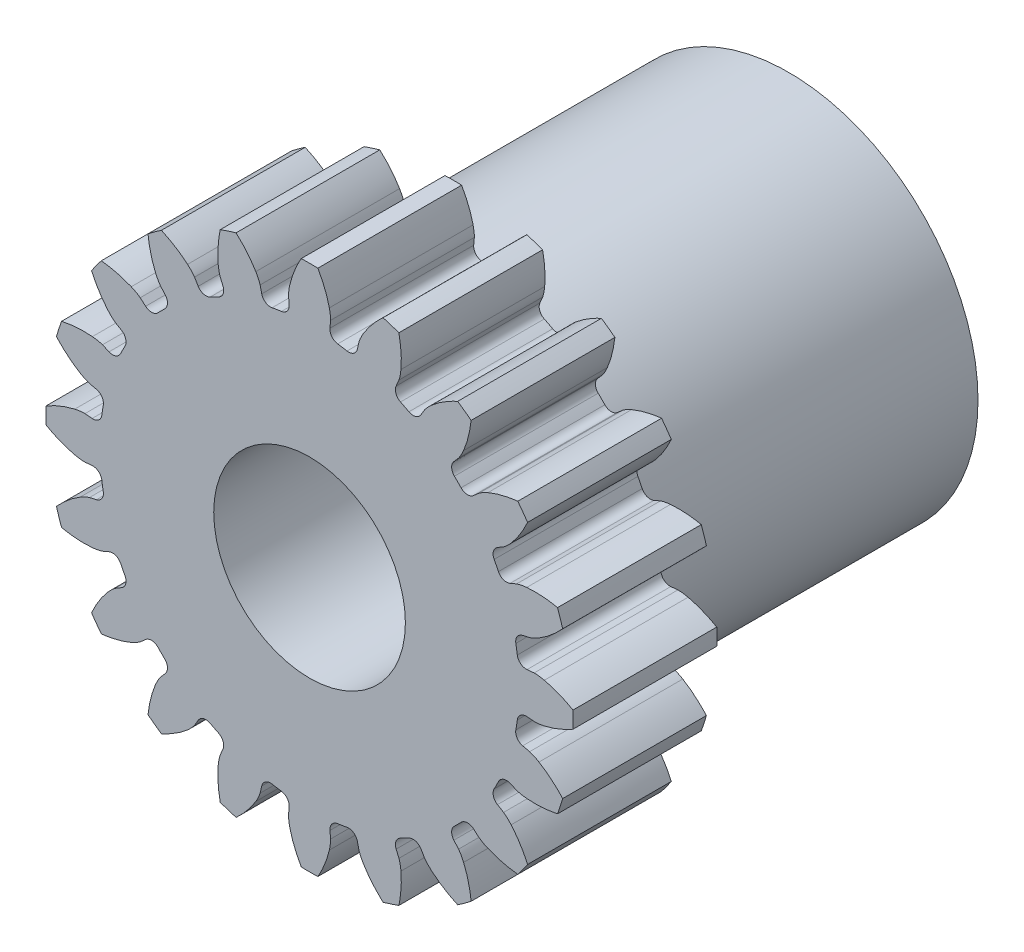
from build123d import *

# Parameters (mm, degrees)
GEAR_DEPTH          = 3
SKETCH2_R           = 2
CUT_EXTRUDE1_DEPTH  = 9.33738853
BOSS_EXTRUDE2_START = 7
SKETCH3_R           = 3.95
SKETCH3_R_2         = 2
BOSS_EXTRUDE2_DEPTH = 7


with BuildPart() as part:
    # Sketch1 → Gear (new body)
    with BuildSketch(Plane(origin=(0, 0, 0), x_dir=(-1, 0, 0), z_dir=(0, 0, -1))):
        with BuildLine():
            Line((-4.447597009, -0.997907739), (-4.593150548, -1.030951362))
            add(Edge.make_bspline(
                [(-4.593150548, -1.030951362), (-4.607739563, -1.035181454), (-4.622055526, -1.040358785), (-4.636198283, -1.045900937), (-4.662441481, -1.056184915), (-4.688118407, -1.067952908), (-4.713324038, -1.08056805), (-4.738693189, -1.093265033), (-4.763614791, -1.106879219), (-4.788129339, -1.12115662)],
                knots=[0, 0, 0, 0, 4.557e-05, 4.557e-05, 4.557e-05, 0.000130165, 0.000130165, 0.000130165, 0.000215282, 0.000215282, 0.000215282, 0.000215282], degree=3))
            add(Edge.make_bspline(
                [(-4.788129339, -1.12115662), (-4.850531317, -1.157765967), (-4.910385417, -1.198902982), (-4.967788285, -1.242938898), (-5.024279533, -1.286275476), (-5.07855745, -1.332599816), (-5.130709538, -1.381071248), (-5.183277961, -1.429929632), (-5.233785889, -1.4810728), (-5.282338139, -1.533924098)],
                knots=[0, 0, 0, 0, 0.000217044, 0.000217044, 0.000217044, 0.000430529, 0.000430529, 0.000430529, 0.000645672, 0.000645672, 0.000645672, 0.000645672], degree=3))
            ThreePointArc((-5.282338139, -1.533924098), (-5.231331504, -1.699762643), (-5.175119287, -1.863909792))
            add(Edge.make_bspline(
                [(-5.175119287, -1.863909792), (-5.104303029, -1.878224391), (-5.032900278, -1.889973759), (-4.961170796, -1.898618501), (-4.89053115, -1.907131897), (-4.819435398, -1.912658885), (-4.748307578, -1.914467437), (-4.676414999, -1.916295434), (-4.604249783, -1.914376237), (-4.532677333, -1.907357053)],
                knots=[0, 0, 0, 0, 0.000216746, 0.000216746, 0.000216746, 0.000430242, 0.000430242, 0.000430242, 0.000646143, 0.000646143, 0.000646143, 0.000646143], degree=3))
            add(Edge.make_bspline(
                [(-4.532677333, -1.907357053), (-4.502477049, -1.904298338), (-4.47234349, -1.900353611), (-4.442423468, -1.895234504), (-4.422083324, -1.891754447), (-4.40182201, -1.887732217), (-4.381743733, -1.882968286), (-4.361550012, -1.878176964), (-4.341438488, -1.872769647), (-4.321914858, -1.865728981)],
                knots=[0, 0, 0, 0, 9.1064e-05, 9.1064e-05, 9.1064e-05, 0.000152959, 0.000152959, 0.000152959, 0.000215246, 0.000215246, 0.000215246, 0.000215246], degree=3))
            Line((-4.321914858, -1.865728981), (-4.184737016, -1.806907611))
            ThreePointArc((-4.184737016, -1.806907611), (-4.045056402, -1.803653853), (-3.941905868, -1.897894413))
            ThreePointArc((-3.941905868, -1.897894413), (-3.898153551, -1.98620844), (-3.852422969, -2.073514491))
            ThreePointArc((-3.852422969, -2.073514491), (-3.836810612, -2.212358376), (-3.921545667, -2.323449717))
            Line((-3.921545667, -2.323449717), (-4.049764268, -2.399854588))
            add(Edge.make_bspline(
                [(-4.049764268, -2.399854588), (-4.062332075, -2.408385898), (-4.074347482, -2.417733708), (-4.086085424, -2.42737496), (-4.107866264, -2.445265199), (-4.128649963, -2.464391831), (-4.148723649, -2.484178513), (-4.168927562, -2.504093561), (-4.188422399, -2.524742619), (-4.20732516, -2.545896646)],
                knots=[0, 0, 0, 0, 4.557e-05, 4.557e-05, 4.557e-05, 0.000130165, 0.000130165, 0.000130165, 0.000215282, 0.000215282, 0.000215282, 0.000215282], degree=3))
            add(Edge.make_bspline(
                [(-4.20732516, -2.545896646), (-4.255360057, -2.599997476), (-4.299572652, -2.657617037), (-4.340558177, -2.717236143), (-4.380892808, -2.775908434), (-4.418199167, -2.836738297), (-4.452820254, -2.898953251), (-4.487717723, -2.961664871), (-4.519949509, -3.025912722), (-4.549793494, -3.091180764)],
                knots=[0, 0, 0, 0, 0.000217044, 0.000217044, 0.000217044, 0.000430529, 0.000430529, 0.000430529, 0.000645672, 0.000645672, 0.000645672, 0.000645672], degree=3))
            ThreePointArc((-4.549793494, -3.091180764), (-4.450036373, -3.233140676), (-4.345851119, -3.371883362))
            add(Edge.make_bspline(
                [(-4.345851119, -3.371883362), (-4.274077401, -3.363613927), (-4.202538595, -3.352723576), (-4.131648432, -3.338779585), (-4.061835351, -3.325047455), (-3.99251134, -3.308334137), (-3.92430589, -3.288074467), (-3.855367103, -3.267596967), (-3.787326968, -3.243471424), (-3.72142657, -3.21467868)],
                knots=[0, 0, 0, 0, 0.000216746, 0.000216746, 0.000216746, 0.000430242, 0.000430242, 0.000430242, 0.000646143, 0.000646143, 0.000646143, 0.000646143], degree=3))
            add(Edge.make_bspline(
                [(-3.72142657, -3.21467868), (-3.693649588, -3.202437268), (-3.666209858, -3.189373828), (-3.639336118, -3.175259473), (-3.621066887, -3.165664292), (-3.60304017, -3.155577834), (-3.585416729, -3.144842537), (-3.56769196, -3.134045516), (-3.550235716, -3.122688049), (-3.533843326, -3.109958845)],
                knots=[0, 0, 0, 0, 9.1064e-05, 9.1064e-05, 9.1064e-05, 0.000152959, 0.000152959, 0.000152959, 0.000215246, 0.000215246, 0.000215246, 0.000215246], degree=3))
            Line((-3.533843326, -3.109958845), (-3.421556249, -3.011626113))
            ThreePointArc((-3.421556249, -3.011626113), (-3.289717557, -2.965367922), (-3.162493635, -3.023120752))
            ThreePointArc((-3.162493635, -3.023120752), (-3.093592174, -3.093592174), (-3.023120752, -3.162493635))
            ThreePointArc((-3.023120752, -3.162493635), (-2.965367398, -3.289717534), (-3.011626113, -3.421556249))
            Line((-3.011626113, -3.421556249), (-3.109958845, -3.533843326))
            add(Edge.make_bspline(
                [(-3.109958845, -3.533843326), (-3.11927522, -3.54584075), (-3.127813919, -3.558444011), (-3.135998054, -3.57124061), (-3.151184477, -3.594985888), (-3.165040494, -3.619598912), (-3.178017283, -3.644620275), (-3.191078258, -3.669803963), (-3.20323804, -3.695466621), (-3.21467868, -3.72142657)],
                knots=[0, 0, 0, 0, 4.557e-05, 4.557e-05, 4.557e-05, 0.000130165, 0.000130165, 0.000130165, 0.000215282, 0.000215282, 0.000215282, 0.000215282], degree=3))
            add(Edge.make_bspline(
                [(-3.21467868, -3.72142657), (-3.243644506, -3.787723117), (-3.267887759, -3.856185019), (-3.288443993, -3.925551382), (-3.308673772, -3.993816133), (-3.325356765, -4.06319707), (-3.339057898, -4.133065511), (-3.352868407, -4.203491717), (-3.363668979, -4.274555224), (-3.371883362, -4.345851119)],
                knots=[0, 0, 0, 0, 0.000217044, 0.000217044, 0.000217044, 0.000430529, 0.000430529, 0.000430529, 0.000645672, 0.000645672, 0.000645672, 0.000645672], degree=3))
            ThreePointArc((-3.371883362, -4.345851119), (-3.233140676, -4.450036373), (-3.091180764, -4.549793494))
            add(Edge.make_bspline(
                [(-3.091180764, -4.549793494), (-3.025475297, -4.519749495), (-2.960803153, -4.48728545), (-2.897691532, -4.452117661), (-2.835538809, -4.417484201), (-2.774772455, -4.380166594), (-2.7161658, -4.339821859), (-2.656929012, -4.299043342), (-2.599674201, -4.255073029), (-2.545896646, -4.20732516)],
                knots=[0, 0, 0, 0, 0.000216746, 0.000216746, 0.000216746, 0.000430242, 0.000430242, 0.000430242, 0.000646143, 0.000646143, 0.000646143, 0.000646143], degree=3))
            add(Edge.make_bspline(
                [(-2.545896646, -4.20732516), (-2.52326197, -4.187099325), (-2.501202061, -4.166195913), (-2.480005191, -4.144467921), (-2.465595194, -4.129696859), (-2.451567655, -4.114533505), (-2.438124156, -4.098877689), (-2.424603361, -4.083131857), (-2.411511137, -4.066935988), (-2.399854588, -4.049764268)],
                knots=[0, 0, 0, 0, 9.1064e-05, 9.1064e-05, 9.1064e-05, 0.000152959, 0.000152959, 0.000152959, 0.000215246, 0.000215246, 0.000215246, 0.000215246], degree=3))
            Line((-2.399854588, -4.049764268), (-2.323449717, -3.921545667))
            ThreePointArc((-2.323449717, -3.921545667), (-2.212358237, -3.836811117), (-2.073514491, -3.852422969))
            ThreePointArc((-2.073514491, -3.852422969), (-1.98620844, -3.898153551), (-1.897894413, -3.941905868))
            ThreePointArc((-1.897894413, -3.941905868), (-1.803653363, -4.045056218), (-1.806907611, -4.184737016))
            Line((-1.806907611, -4.184737016), (-1.865728981, -4.321914858))
            add(Edge.make_bspline(
                [(-1.865728981, -4.321914858), (-1.870881973, -4.336204004), (-1.875108136, -4.35082902), (-1.878937345, -4.365528346), (-1.886042797, -4.39280431), (-1.891614809, -4.420494432), (-1.896224443, -4.448301211), (-1.900863981, -4.476288385), (-1.904498424, -4.504452602), (-1.907357053, -4.532677333)],
                knots=[0, 0, 0, 0, 4.557e-05, 4.557e-05, 4.557e-05, 0.000130165, 0.000130165, 0.000130165, 0.000215282, 0.000215282, 0.000215282, 0.000215282], degree=3))
            add(Edge.make_bspline(
                [(-1.907357053, -4.532677333), (-1.914418431, -4.604680028), (-1.916319244, -4.677282743), (-1.914433999, -4.749606301), (-1.912578693, -4.820781282), (-1.907005274, -4.891921803), (-1.89844529, -4.962604522), (-1.889816971, -5.033851506), (-1.878129094, -5.104774478), (-1.863909792, -5.175119287)],
                knots=[0, 0, 0, 0, 0.000217044, 0.000217044, 0.000217044, 0.000430529, 0.000430529, 0.000430529, 0.000645672, 0.000645672, 0.000645672, 0.000645672], degree=3))
            ThreePointArc((-1.863909792, -5.175119287), (-1.699762643, -5.231331504), (-1.533924098, -5.282338139))
            add(Edge.make_bspline(
                [(-1.533924098, -5.282338139), (-1.480718592, -5.233460493), (-1.42924367, -5.182600559), (-1.380088395, -5.129651441), (-1.331679971, -5.077506815), (-1.285419509, -5.023237826), (-1.242148476, -4.966757251), (-1.198412198, -4.909669402), (-1.157547211, -4.85015844), (-1.12115662, -4.788129339)],
                knots=[0, 0, 0, 0, 0.000216746, 0.000216746, 0.000216746, 0.000430242, 0.000430242, 0.000430242, 0.000646143, 0.000646143, 0.000646143, 0.000646143], degree=3))
            add(Edge.make_bspline(
                [(-1.12115662, -4.788129339), (-1.105879891, -4.761898928), (-1.09135918, -4.735201714), (-1.077914077, -4.707986973), (-1.068773865, -4.689485925), (-1.060118616, -4.67072997), (-1.052171002, -4.651686134), (-1.044177692, -4.632532803), (-1.036731046, -4.613083896), (-1.030951362, -4.593150548)],
                knots=[0, 0, 0, 0, 9.1064e-05, 9.1064e-05, 9.1064e-05, 0.000152959, 0.000152959, 0.000152959, 0.000215246, 0.000215246, 0.000215246, 0.000215246], degree=3))
            Line((-1.030951362, -4.593150548), (-0.997907739, -4.447597009))
            ThreePointArc((-0.997907739, -4.447597009), (-0.918437878, -4.332680507), (-0.781565302, -4.304623184))
            ThreePointArc((-0.781565302, -4.304623184), (-0.684400786, -4.321136498), (-0.586888945, -4.335456889))
            ThreePointArc((-0.586888945, -4.335456889), (-0.465385169, -4.404436616), (-0.425316402, -4.538286567))
            Line((-0.425316402, -4.538286567), (-0.438868566, -4.68692725))
            add(Edge.make_bspline(
                [(-0.438868566, -4.68692725), (-0.439353763, -4.702109398), (-0.438853705, -4.717324571), (-0.437953157, -4.732487752), (-0.436282107, -4.76062444), (-0.433024688, -4.788681158), (-0.428815942, -4.816551431), (-0.424579893, -4.844602511), (-0.419333232, -4.872511378), (-0.413330028, -4.900238058)],
                knots=[0, 0, 0, 0, 4.557e-05, 4.557e-05, 4.557e-05, 0.000130165, 0.000130165, 0.000130165, 0.000215282, 0.000215282, 0.000215282, 0.000215282], degree=3))
            add(Edge.make_bspline(
                [(-0.413330028, -4.900238058), (-0.397795742, -4.970898776), (-0.377168049, -5.040535445), (-0.353025866, -5.108736663), (-0.329267087, -5.175854771), (-0.301982821, -5.241791146), (-0.27199963, -5.306369226), (-0.241777082, -5.371462837), (-0.208744847, -5.435302839), (-0.173483746, -5.497810722)],
                knots=[0, 0, 0, 0, 0.000217044, 0.000217044, 0.000217044, 0.000430529, 0.000430529, 0.000430529, 0.000645672, 0.000645672, 0.000645672, 0.000645672], degree=3))
            ThreePointArc((-0.173483746, -5.497810722), (0, -5.500547459), (0.173483746, -5.497810722))
            add(Edge.make_bspline(
                [(0.173483746, -5.497810722), (0.208981166, -5.434883913), (0.242220142, -5.370606616), (0.272607409, -5.305059197), (0.302532981, -5.240507685), (0.329759255, -5.17459954), (0.353458995, -5.107511837), (0.377413552, -5.039702813), (0.397888565, -4.970476549), (0.413330028, -4.900238058)],
                knots=[0, 0, 0, 0, 0.000216746, 0.000216746, 0.000216746, 0.000430242, 0.000430242, 0.000430242, 0.000646143, 0.000646143, 0.000646143, 0.000646143], degree=3))
            add(Edge.make_bspline(
                [(0.413330028, -4.900238058), (0.419753418, -4.870570685), (0.425313542, -4.84069298), (0.429690777, -4.810655458), (0.432666497, -4.790235434), (0.435102219, -4.769722842), (0.43677598, -4.74915513), (0.438459365, -4.728469161), (0.439531503, -4.707671011), (0.438868566, -4.68692725)],
                knots=[0, 0, 0, 0, 9.1064e-05, 9.1064e-05, 9.1064e-05, 0.000152959, 0.000152959, 0.000152959, 0.000215246, 0.000215246, 0.000215246, 0.000215246], degree=3))
            Line((0.438868566, -4.68692725), (0.425316402, -4.538286567))
            ThreePointArc((0.425316402, -4.538286567), (0.465385579, -4.404436942), (0.586888945, -4.335456889))
            ThreePointArc((0.586888945, -4.335456889), (0.684400786, -4.321136498), (0.781565302, -4.304623184))
            ThreePointArc((0.781565302, -4.304623184), (0.918438167, -4.33268007), (0.997907739, -4.447597009))
            Line((0.997907739, -4.447597009), (1.030951362, -4.593150548))
            add(Edge.make_bspline(
                [(1.030951362, -4.593150548), (1.035181454, -4.607739563), (1.040358785, -4.622055526), (1.045900937, -4.636198283), (1.056184915, -4.662441481), (1.067952908, -4.688118407), (1.08056805, -4.713324038), (1.093265033, -4.738693189), (1.106879219, -4.763614791), (1.12115662, -4.788129339)],
                knots=[0, 0, 0, 0, 4.557e-05, 4.557e-05, 4.557e-05, 0.000130165, 0.000130165, 0.000130165, 0.000215282, 0.000215282, 0.000215282, 0.000215282], degree=3))
            add(Edge.make_bspline(
                [(1.12115662, -4.788129339), (1.157765967, -4.850531317), (1.198902982, -4.910385417), (1.242938898, -4.967788285), (1.286275476, -5.024279533), (1.332599816, -5.07855745), (1.381071248, -5.130709538), (1.429929632, -5.183277961), (1.4810728, -5.233785889), (1.533924098, -5.282338139)],
                knots=[0, 0, 0, 0, 0.000217044, 0.000217044, 0.000217044, 0.000430529, 0.000430529, 0.000430529, 0.000645672, 0.000645672, 0.000645672, 0.000645672], degree=3))
            ThreePointArc((1.533924098, -5.282338139), (1.699762643, -5.231331504), (1.863909792, -5.175119287))
            add(Edge.make_bspline(
                [(1.863909792, -5.175119287), (1.878224391, -5.104303029), (1.889973759, -5.032900278), (1.898618501, -4.961170796), (1.907131897, -4.89053115), (1.912658885, -4.819435398), (1.914467437, -4.748307578), (1.916295434, -4.676414999), (1.914376237, -4.604249783), (1.907357053, -4.532677333)],
                knots=[0, 0, 0, 0, 0.000216746, 0.000216746, 0.000216746, 0.000430242, 0.000430242, 0.000430242, 0.000646143, 0.000646143, 0.000646143, 0.000646143], degree=3))
            add(Edge.make_bspline(
                [(1.907357053, -4.532677333), (1.904298338, -4.502477049), (1.900353611, -4.472343489), (1.895234504, -4.442423468), (1.891754447, -4.422083324), (1.887732217, -4.40182201), (1.882968286, -4.381743733), (1.878176964, -4.361550012), (1.872769647, -4.341438488), (1.865728981, -4.321914858)],
                knots=[0, 0, 0, 0, 9.1064e-05, 9.1064e-05, 9.1064e-05, 0.000152959, 0.000152959, 0.000152959, 0.000215246, 0.000215246, 0.000215246, 0.000215246], degree=3))
            Line((1.865728981, -4.321914858), (1.806907611, -4.184737016))
            ThreePointArc((1.806907611, -4.184737016), (1.803653853, -4.045056402), (1.897894413, -3.941905868))
            ThreePointArc((1.897894413, -3.941905868), (1.98620844, -3.898153551), (2.073514491, -3.852422969))
            ThreePointArc((2.073514491, -3.852422969), (2.212358376, -3.836810612), (2.323449717, -3.921545667))
            Line((2.323449717, -3.921545667), (2.399854588, -4.049764268))
            add(Edge.make_bspline(
                [(2.399854588, -4.049764268), (2.408385898, -4.062332075), (2.417733708, -4.074347482), (2.42737496, -4.086085424), (2.445265199, -4.107866264), (2.464391831, -4.128649963), (2.484178513, -4.148723649), (2.504093561, -4.168927562), (2.524742619, -4.188422399), (2.545896646, -4.20732516)],
                knots=[0, 0, 0, 0, 4.557e-05, 4.557e-05, 4.557e-05, 0.000130165, 0.000130165, 0.000130165, 0.000215282, 0.000215282, 0.000215282, 0.000215282], degree=3))
            add(Edge.make_bspline(
                [(2.545896646, -4.20732516), (2.599997476, -4.255360057), (2.657617037, -4.299572652), (2.717236143, -4.340558177), (2.775908434, -4.380892808), (2.836738297, -4.418199167), (2.898953251, -4.452820254), (2.961664871, -4.487717723), (3.025912722, -4.519949509), (3.091180764, -4.549793494)],
                knots=[0, 0, 0, 0, 0.000217044, 0.000217044, 0.000217044, 0.000430529, 0.000430529, 0.000430529, 0.000645672, 0.000645672, 0.000645672, 0.000645672], degree=3))
            ThreePointArc((3.091180764, -4.549793494), (3.233140676, -4.450036373), (3.371883362, -4.345851119))
            add(Edge.make_bspline(
                [(3.371883362, -4.345851119), (3.363613927, -4.274077401), (3.352723576, -4.202538595), (3.338779585, -4.131648432), (3.325047455, -4.061835351), (3.308334137, -3.99251134), (3.288074467, -3.92430589), (3.267596967, -3.855367103), (3.243471424, -3.787326968), (3.21467868, -3.72142657)],
                knots=[0, 0, 0, 0, 0.000216746, 0.000216746, 0.000216746, 0.000430242, 0.000430242, 0.000430242, 0.000646143, 0.000646143, 0.000646143, 0.000646143], degree=3))
            add(Edge.make_bspline(
                [(3.21467868, -3.72142657), (3.202437268, -3.693649588), (3.189373828, -3.666209858), (3.175259473, -3.639336118), (3.165664292, -3.621066887), (3.155577834, -3.60304017), (3.144842537, -3.585416729), (3.134045516, -3.56769196), (3.122688049, -3.550235716), (3.109958845, -3.533843326)],
                knots=[0, 0, 0, 0, 9.1064e-05, 9.1064e-05, 9.1064e-05, 0.000152959, 0.000152959, 0.000152959, 0.000215246, 0.000215246, 0.000215246, 0.000215246], degree=3))
            Line((3.109958845, -3.533843326), (3.011626113, -3.421556249))
            ThreePointArc((3.011626113, -3.421556249), (2.965367922, -3.289717557), (3.023120752, -3.162493635))
            ThreePointArc((3.023120752, -3.162493635), (3.093592174, -3.093592174), (3.162493635, -3.023120752))
            ThreePointArc((3.162493635, -3.023120752), (3.289717534, -2.965367398), (3.421556249, -3.011626113))
            Line((3.421556249, -3.011626113), (3.533843326, -3.109958845))
            add(Edge.make_bspline(
                [(3.533843326, -3.109958845), (3.54584075, -3.11927522), (3.558444011, -3.127813919), (3.57124061, -3.135998054), (3.594985888, -3.151184477), (3.619598912, -3.165040494), (3.644620275, -3.178017283), (3.669803963, -3.191078258), (3.695466621, -3.20323804), (3.72142657, -3.21467868)],
                knots=[0, 0, 0, 0, 4.557e-05, 4.557e-05, 4.557e-05, 0.000130165, 0.000130165, 0.000130165, 0.000215282, 0.000215282, 0.000215282, 0.000215282], degree=3))
            add(Edge.make_bspline(
                [(3.72142657, -3.21467868), (3.787723117, -3.243644506), (3.856185019, -3.267887759), (3.925551382, -3.288443993), (3.993816133, -3.308673772), (4.06319707, -3.325356765), (4.133065511, -3.339057898), (4.203491717, -3.352868407), (4.274555224, -3.363668979), (4.345851119, -3.371883362)],
                knots=[0, 0, 0, 0, 0.000217044, 0.000217044, 0.000217044, 0.000430529, 0.000430529, 0.000430529, 0.000645672, 0.000645672, 0.000645672, 0.000645672], degree=3))
            ThreePointArc((4.345851119, -3.371883362), (4.450036373, -3.233140676), (4.549793494, -3.091180764))
            add(Edge.make_bspline(
                [(4.549793494, -3.091180764), (4.519749495, -3.025475297), (4.48728545, -2.960803153), (4.452117661, -2.897691532), (4.417484201, -2.835538809), (4.380166594, -2.774772455), (4.339821859, -2.7161658), (4.299043342, -2.656929012), (4.255073029, -2.599674201), (4.20732516, -2.545896646)],
                knots=[0, 0, 0, 0, 0.000216746, 0.000216746, 0.000216746, 0.000430242, 0.000430242, 0.000430242, 0.000646143, 0.000646143, 0.000646143, 0.000646143], degree=3))
            add(Edge.make_bspline(
                [(4.20732516, -2.545896646), (4.187099325, -2.52326197), (4.166195913, -2.501202061), (4.144467921, -2.480005191), (4.129696859, -2.465595194), (4.114533505, -2.451567655), (4.098877689, -2.438124155), (4.083131857, -2.424603361), (4.066935988, -2.411511137), (4.049764268, -2.399854588)],
                knots=[0, 0, 0, 0, 9.1064e-05, 9.1064e-05, 9.1064e-05, 0.000152959, 0.000152959, 0.000152959, 0.000215246, 0.000215246, 0.000215246, 0.000215246], degree=3))
            Line((4.049764268, -2.399854588), (3.921545667, -2.323449717))
            ThreePointArc((3.921545667, -2.323449717), (3.836811117, -2.212358237), (3.852422969, -2.073514491))
            ThreePointArc((3.852422969, -2.073514491), (3.898153551, -1.98620844), (3.941905868, -1.897894413))
            ThreePointArc((3.941905868, -1.897894413), (4.045056218, -1.803653363), (4.184737016, -1.806907611))
            Line((4.184737016, -1.806907611), (4.321914858, -1.865728981))
            add(Edge.make_bspline(
                [(4.321914858, -1.865728981), (4.336204004, -1.870881973), (4.35082902, -1.875108136), (4.365528346, -1.878937345), (4.39280431, -1.886042797), (4.420494432, -1.891614809), (4.448301211, -1.896224443), (4.476288385, -1.900863981), (4.504452602, -1.904498424), (4.532677333, -1.907357053)],
                knots=[0, 0, 0, 0, 4.557e-05, 4.557e-05, 4.557e-05, 0.000130165, 0.000130165, 0.000130165, 0.000215282, 0.000215282, 0.000215282, 0.000215282], degree=3))
            add(Edge.make_bspline(
                [(4.532677333, -1.907357053), (4.604680028, -1.914418431), (4.677282743, -1.916319244), (4.749606301, -1.914433999), (4.820781282, -1.912578693), (4.891921803, -1.907005274), (4.962604522, -1.89844529), (5.033851506, -1.889816971), (5.104774478, -1.878129094), (5.175119287, -1.863909792)],
                knots=[0, 0, 0, 0, 0.000217044, 0.000217044, 0.000217044, 0.000430529, 0.000430529, 0.000430529, 0.000645672, 0.000645672, 0.000645672, 0.000645672], degree=3))
            ThreePointArc((5.175119287, -1.863909792), (5.231331504, -1.699762643), (5.282338139, -1.533924098))
            add(Edge.make_bspline(
                [(5.282338139, -1.533924098), (5.233460493, -1.480718592), (5.182600559, -1.42924367), (5.129651441, -1.380088395), (5.077506815, -1.331679971), (5.023237826, -1.285419509), (4.966757251, -1.242148476), (4.909669402, -1.198412198), (4.85015844, -1.157547211), (4.788129339, -1.12115662)],
                knots=[0, 0, 0, 0, 0.000216746, 0.000216746, 0.000216746, 0.000430242, 0.000430242, 0.000430242, 0.000646143, 0.000646143, 0.000646143, 0.000646143], degree=3))
            add(Edge.make_bspline(
                [(4.788129339, -1.12115662), (4.761898928, -1.105879891), (4.735201714, -1.09135918), (4.707986973, -1.077914077), (4.689485925, -1.068773865), (4.67072997, -1.060118616), (4.651686134, -1.052171002), (4.632532803, -1.044177692), (4.613083896, -1.036731046), (4.593150548, -1.030951362)],
                knots=[0, 0, 0, 0, 9.1064e-05, 9.1064e-05, 9.1064e-05, 0.000152959, 0.000152959, 0.000152959, 0.000215246, 0.000215246, 0.000215246, 0.000215246], degree=3))
            Line((4.593150548, -1.030951362), (4.447597009, -0.997907739))
            ThreePointArc((4.447597009, -0.997907739), (4.332680507, -0.918437878), (4.304623184, -0.781565302))
            ThreePointArc((4.304623184, -0.781565302), (4.321136498, -0.684400786), (4.335456889, -0.586888945))
            ThreePointArc((4.335456889, -0.586888945), (4.404436616, -0.465385169), (4.538286567, -0.425316402))
            Line((4.538286567, -0.425316402), (4.68692725, -0.438868566))
            add(Edge.make_bspline(
                [(4.68692725, -0.438868566), (4.702109398, -0.439353763), (4.717324571, -0.438853705), (4.732487752, -0.437953157), (4.76062444, -0.436282107), (4.788681158, -0.433024688), (4.816551431, -0.428815942), (4.844602511, -0.424579893), (4.872511378, -0.419333232), (4.900238058, -0.413330028)],
                knots=[0, 0, 0, 0, 4.557e-05, 4.557e-05, 4.557e-05, 0.000130165, 0.000130165, 0.000130165, 0.000215282, 0.000215282, 0.000215282, 0.000215282], degree=3))
            add(Edge.make_bspline(
                [(4.900238058, -0.413330028), (4.970898776, -0.397795742), (5.040535445, -0.377168049), (5.108736663, -0.353025866), (5.175854771, -0.329267087), (5.241791146, -0.301982821), (5.306369226, -0.27199963), (5.371462837, -0.241777082), (5.435302839, -0.208744847), (5.497810722, -0.173483746)],
                knots=[0, 0, 0, 0, 0.000217044, 0.000217044, 0.000217044, 0.000430529, 0.000430529, 0.000430529, 0.000645672, 0.000645672, 0.000645672, 0.000645672], degree=3))
            ThreePointArc((5.497810722, -0.173483746), (5.500547459, 0), (5.497810722, 0.173483746))
            add(Edge.make_bspline(
                [(5.497810722, 0.173483746), (5.434883913, 0.208981166), (5.370606616, 0.242220142), (5.305059197, 0.272607409), (5.240507685, 0.302532981), (5.17459954, 0.329759255), (5.107511837, 0.353458995), (5.039702813, 0.377413552), (4.970476549, 0.397888565), (4.900238058, 0.413330028)],
                knots=[0, 0, 0, 0, 0.000216746, 0.000216746, 0.000216746, 0.000430242, 0.000430242, 0.000430242, 0.000646143, 0.000646143, 0.000646143, 0.000646143], degree=3))
            add(Edge.make_bspline(
                [(4.900238058, 0.413330028), (4.870570685, 0.419753418), (4.84069298, 0.425313542), (4.810655458, 0.429690777), (4.790235434, 0.432666497), (4.769722842, 0.435102219), (4.74915513, 0.43677598), (4.728469161, 0.438459365), (4.707671011, 0.439531503), (4.68692725, 0.438868566)],
                knots=[0, 0, 0, 0, 9.1064e-05, 9.1064e-05, 9.1064e-05, 0.000152959, 0.000152959, 0.000152959, 0.000215246, 0.000215246, 0.000215246, 0.000215246], degree=3))
            Line((4.68692725, 0.438868566), (4.538286567, 0.425316402))
            ThreePointArc((4.538286567, 0.425316402), (4.404436942, 0.465385579), (4.335456889, 0.586888945))
            ThreePointArc((4.335456889, 0.586888945), (4.321136498, 0.684400786), (4.304623184, 0.781565302))
            ThreePointArc((4.304623184, 0.781565302), (4.33268007, 0.918438167), (4.447597009, 0.997907739))
            Line((4.447597009, 0.997907739), (4.593150548, 1.030951362))
            add(Edge.make_bspline(
                [(4.593150548, 1.030951362), (4.607739563, 1.035181454), (4.622055526, 1.040358785), (4.636198283, 1.045900937), (4.662441481, 1.056184915), (4.688118407, 1.067952908), (4.713324038, 1.08056805), (4.738693189, 1.093265033), (4.763614791, 1.106879219), (4.788129339, 1.12115662)],
                knots=[0, 0, 0, 0, 4.557e-05, 4.557e-05, 4.557e-05, 0.000130165, 0.000130165, 0.000130165, 0.000215282, 0.000215282, 0.000215282, 0.000215282], degree=3))
            add(Edge.make_bspline(
                [(4.788129339, 1.12115662), (4.850531317, 1.157765967), (4.910385417, 1.198902982), (4.967788285, 1.242938898), (5.024279533, 1.286275476), (5.07855745, 1.332599816), (5.130709538, 1.381071248), (5.183277961, 1.429929632), (5.233785889, 1.4810728), (5.282338139, 1.533924098)],
                knots=[0, 0, 0, 0, 0.000217044, 0.000217044, 0.000217044, 0.000430529, 0.000430529, 0.000430529, 0.000645672, 0.000645672, 0.000645672, 0.000645672], degree=3))
            ThreePointArc((5.282338139, 1.533924098), (5.231331504, 1.699762643), (5.175119287, 1.863909792))
            add(Edge.make_bspline(
                [(5.175119287, 1.863909792), (5.104303029, 1.878224391), (5.032900278, 1.889973759), (4.961170796, 1.898618501), (4.89053115, 1.907131897), (4.819435398, 1.912658885), (4.748307578, 1.914467437), (4.676414999, 1.916295434), (4.604249783, 1.914376237), (4.532677333, 1.907357053)],
                knots=[0, 0, 0, 0, 0.000216746, 0.000216746, 0.000216746, 0.000430242, 0.000430242, 0.000430242, 0.000646143, 0.000646143, 0.000646143, 0.000646143], degree=3))
            add(Edge.make_bspline(
                [(4.532677333, 1.907357053), (4.502477049, 1.904298338), (4.472343489, 1.900353611), (4.442423468, 1.895234504), (4.422083324, 1.891754447), (4.40182201, 1.887732217), (4.381743733, 1.882968286), (4.361550012, 1.878176964), (4.341438488, 1.872769647), (4.321914858, 1.865728981)],
                knots=[0, 0, 0, 0, 9.1064e-05, 9.1064e-05, 9.1064e-05, 0.000152959, 0.000152959, 0.000152959, 0.000215246, 0.000215246, 0.000215246, 0.000215246], degree=3))
            Line((4.321914858, 1.865728981), (4.184737016, 1.806907611))
            ThreePointArc((4.184737016, 1.806907611), (4.045056402, 1.803653853), (3.941905868, 1.897894413))
            ThreePointArc((3.941905868, 1.897894413), (3.898153551, 1.98620844), (3.852422969, 2.073514491))
            ThreePointArc((3.852422969, 2.073514491), (3.836810612, 2.212358376), (3.921545667, 2.323449717))
            Line((3.921545667, 2.323449717), (4.049764268, 2.399854588))
            add(Edge.make_bspline(
                [(4.049764268, 2.399854588), (4.062332075, 2.408385898), (4.074347482, 2.417733708), (4.086085424, 2.42737496), (4.107866264, 2.445265199), (4.128649963, 2.464391831), (4.148723649, 2.484178513), (4.168927562, 2.504093561), (4.188422399, 2.524742619), (4.20732516, 2.545896646)],
                knots=[0, 0, 0, 0, 4.557e-05, 4.557e-05, 4.557e-05, 0.000130165, 0.000130165, 0.000130165, 0.000215282, 0.000215282, 0.000215282, 0.000215282], degree=3))
            add(Edge.make_bspline(
                [(4.20732516, 2.545896646), (4.255360057, 2.599997476), (4.299572652, 2.657617037), (4.340558177, 2.717236143), (4.380892808, 2.775908434), (4.418199167, 2.836738297), (4.452820254, 2.898953251), (4.487717723, 2.961664871), (4.519949509, 3.025912722), (4.549793494, 3.091180764)],
                knots=[0, 0, 0, 0, 0.000217044, 0.000217044, 0.000217044, 0.000430529, 0.000430529, 0.000430529, 0.000645672, 0.000645672, 0.000645672, 0.000645672], degree=3))
            ThreePointArc((4.549793494, 3.091180764), (4.450036373, 3.233140676), (4.345851119, 3.371883362))
            add(Edge.make_bspline(
                [(4.345851119, 3.371883362), (4.274077401, 3.363613927), (4.202538595, 3.352723576), (4.131648432, 3.338779585), (4.061835351, 3.325047455), (3.99251134, 3.308334137), (3.92430589, 3.288074467), (3.855367103, 3.267596967), (3.787326968, 3.243471424), (3.72142657, 3.21467868)],
                knots=[0, 0, 0, 0, 0.000216746, 0.000216746, 0.000216746, 0.000430242, 0.000430242, 0.000430242, 0.000646143, 0.000646143, 0.000646143, 0.000646143], degree=3))
            add(Edge.make_bspline(
                [(3.72142657, 3.21467868), (3.693649588, 3.202437268), (3.666209858, 3.189373828), (3.639336118, 3.175259473), (3.621066887, 3.165664292), (3.60304017, 3.155577834), (3.585416729, 3.144842537), (3.56769196, 3.134045516), (3.550235716, 3.122688049), (3.533843326, 3.109958845)],
                knots=[0, 0, 0, 0, 9.1064e-05, 9.1064e-05, 9.1064e-05, 0.000152959, 0.000152959, 0.000152959, 0.000215246, 0.000215246, 0.000215246, 0.000215246], degree=3))
            Line((3.533843326, 3.109958845), (3.421556249, 3.011626113))
            ThreePointArc((3.421556249, 3.011626113), (3.289717557, 2.965367922), (3.162493635, 3.023120752))
            ThreePointArc((3.162493635, 3.023120752), (3.093592174, 3.093592174), (3.023120752, 3.162493635))
            ThreePointArc((3.023120752, 3.162493635), (2.965367398, 3.289717534), (3.011626113, 3.421556249))
            Line((3.011626113, 3.421556249), (3.109958845, 3.533843326))
            add(Edge.make_bspline(
                [(3.109958845, 3.533843326), (3.11927522, 3.54584075), (3.127813919, 3.558444011), (3.135998054, 3.57124061), (3.151184477, 3.594985888), (3.165040494, 3.619598912), (3.178017283, 3.644620275), (3.191078258, 3.669803963), (3.20323804, 3.695466621), (3.21467868, 3.72142657)],
                knots=[0, 0, 0, 0, 4.557e-05, 4.557e-05, 4.557e-05, 0.000130165, 0.000130165, 0.000130165, 0.000215282, 0.000215282, 0.000215282, 0.000215282], degree=3))
            add(Edge.make_bspline(
                [(3.21467868, 3.72142657), (3.243644506, 3.787723117), (3.267887759, 3.856185019), (3.288443993, 3.925551382), (3.308673772, 3.993816133), (3.325356765, 4.06319707), (3.339057898, 4.133065511), (3.352868407, 4.203491717), (3.363668979, 4.274555224), (3.371883362, 4.345851119)],
                knots=[0, 0, 0, 0, 0.000217044, 0.000217044, 0.000217044, 0.000430529, 0.000430529, 0.000430529, 0.000645672, 0.000645672, 0.000645672, 0.000645672], degree=3))
            ThreePointArc((3.371883362, 4.345851119), (3.233140676, 4.450036373), (3.091180764, 4.549793494))
            add(Edge.make_bspline(
                [(3.091180764, 4.549793494), (3.025475297, 4.519749495), (2.960803153, 4.48728545), (2.897691532, 4.452117661), (2.835538809, 4.417484201), (2.774772455, 4.380166594), (2.7161658, 4.339821859), (2.656929012, 4.299043342), (2.599674201, 4.255073029), (2.545896646, 4.20732516)],
                knots=[0, 0, 0, 0, 0.000216746, 0.000216746, 0.000216746, 0.000430242, 0.000430242, 0.000430242, 0.000646143, 0.000646143, 0.000646143, 0.000646143], degree=3))
            add(Edge.make_bspline(
                [(2.545896646, 4.20732516), (2.52326197, 4.187099325), (2.501202061, 4.166195913), (2.480005191, 4.144467921), (2.465595194, 4.129696859), (2.451567655, 4.114533505), (2.438124156, 4.098877689), (2.424603361, 4.083131857), (2.411511137, 4.066935988), (2.399854588, 4.049764268)],
                knots=[0, 0, 0, 0, 9.1064e-05, 9.1064e-05, 9.1064e-05, 0.000152959, 0.000152959, 0.000152959, 0.000215246, 0.000215246, 0.000215246, 0.000215246], degree=3))
            Line((2.399854588, 4.049764268), (2.323449717, 3.921545667))
            ThreePointArc((2.323449717, 3.921545667), (2.212358237, 3.836811117), (2.073514491, 3.852422969))
            ThreePointArc((2.073514491, 3.852422969), (1.98620844, 3.898153551), (1.897894413, 3.941905868))
            ThreePointArc((1.897894413, 3.941905868), (1.803653363, 4.045056218), (1.806907611, 4.184737016))
            Line((1.806907611, 4.184737016), (1.865728981, 4.321914858))
            add(Edge.make_bspline(
                [(1.865728981, 4.321914858), (1.870881973, 4.336204004), (1.875108136, 4.35082902), (1.878937345, 4.365528346), (1.886042797, 4.39280431), (1.891614809, 4.420494432), (1.896224443, 4.448301211), (1.900863981, 4.476288385), (1.904498424, 4.504452602), (1.907357053, 4.532677333)],
                knots=[0, 0, 0, 0, 4.557e-05, 4.557e-05, 4.557e-05, 0.000130165, 0.000130165, 0.000130165, 0.000215282, 0.000215282, 0.000215282, 0.000215282], degree=3))
            add(Edge.make_bspline(
                [(1.907357053, 4.532677333), (1.914418431, 4.604680028), (1.916319244, 4.677282743), (1.914433999, 4.749606301), (1.912578693, 4.820781282), (1.907005274, 4.891921803), (1.89844529, 4.962604522), (1.889816971, 5.033851506), (1.878129094, 5.104774478), (1.863909792, 5.175119287)],
                knots=[0, 0, 0, 0, 0.000217044, 0.000217044, 0.000217044, 0.000430529, 0.000430529, 0.000430529, 0.000645672, 0.000645672, 0.000645672, 0.000645672], degree=3))
            ThreePointArc((1.863909792, 5.175119287), (1.699762643, 5.231331504), (1.533924098, 5.282338139))
            add(Edge.make_bspline(
                [(1.533924098, 5.282338139), (1.480718592, 5.233460493), (1.42924367, 5.182600559), (1.380088395, 5.129651441), (1.331679971, 5.077506815), (1.285419509, 5.023237826), (1.242148476, 4.966757251), (1.198412198, 4.909669402), (1.157547211, 4.85015844), (1.12115662, 4.788129339)],
                knots=[0, 0, 0, 0, 0.000216746, 0.000216746, 0.000216746, 0.000430242, 0.000430242, 0.000430242, 0.000646143, 0.000646143, 0.000646143, 0.000646143], degree=3))
            add(Edge.make_bspline(
                [(1.12115662, 4.788129339), (1.105879891, 4.761898928), (1.09135918, 4.735201714), (1.077914077, 4.707986973), (1.068773865, 4.689485925), (1.060118616, 4.67072997), (1.052171002, 4.651686134), (1.044177692, 4.632532803), (1.036731046, 4.613083896), (1.030951362, 4.593150548)],
                knots=[0, 0, 0, 0, 9.1064e-05, 9.1064e-05, 9.1064e-05, 0.000152959, 0.000152959, 0.000152959, 0.000215246, 0.000215246, 0.000215246, 0.000215246], degree=3))
            Line((1.030951362, 4.593150548), (0.997907739, 4.447597009))
            ThreePointArc((0.997907739, 4.447597009), (0.918437878, 4.332680507), (0.781565302, 4.304623184))
            ThreePointArc((0.781565302, 4.304623184), (0.684400786, 4.321136498), (0.586888945, 4.335456889))
            ThreePointArc((0.586888945, 4.335456889), (0.465385169, 4.404436616), (0.425316402, 4.538286567))
            Line((0.425316402, 4.538286567), (0.438868566, 4.68692725))
            add(Edge.make_bspline(
                [(0.438868566, 4.68692725), (0.439353763, 4.702109398), (0.438853705, 4.717324571), (0.437953157, 4.732487752), (0.436282107, 4.76062444), (0.433024688, 4.788681158), (0.428815942, 4.816551431), (0.424579893, 4.844602511), (0.419333232, 4.872511378), (0.413330028, 4.900238058)],
                knots=[0, 0, 0, 0, 4.557e-05, 4.557e-05, 4.557e-05, 0.000130165, 0.000130165, 0.000130165, 0.000215282, 0.000215282, 0.000215282, 0.000215282], degree=3))
            add(Edge.make_bspline(
                [(0.413330028, 4.900238058), (0.397795742, 4.970898776), (0.377168049, 5.040535445), (0.353025866, 5.108736663), (0.329267087, 5.175854771), (0.301982821, 5.241791146), (0.27199963, 5.306369226), (0.241777082, 5.371462837), (0.208744847, 5.435302839), (0.173483746, 5.497810722)],
                knots=[0, 0, 0, 0, 0.000217044, 0.000217044, 0.000217044, 0.000430529, 0.000430529, 0.000430529, 0.000645672, 0.000645672, 0.000645672, 0.000645672], degree=3))
            ThreePointArc((0.173483746, 5.497810722), (0, 5.500547459), (-0.173483746, 5.497810722))
            add(Edge.make_bspline(
                [(-0.173483746, 5.497810722), (-0.208981166, 5.434883913), (-0.242220142, 5.370606616), (-0.272607409, 5.305059197), (-0.302532981, 5.240507685), (-0.329759255, 5.17459954), (-0.353458995, 5.107511837), (-0.377413552, 5.039702813), (-0.397888565, 4.970476549), (-0.413330028, 4.900238058)],
                knots=[0, 0, 0, 0, 0.000216746, 0.000216746, 0.000216746, 0.000430242, 0.000430242, 0.000430242, 0.000646143, 0.000646143, 0.000646143, 0.000646143], degree=3))
            add(Edge.make_bspline(
                [(-0.413330028, 4.900238058), (-0.419753418, 4.870570685), (-0.425313542, 4.84069298), (-0.429690777, 4.810655458), (-0.432666497, 4.790235434), (-0.435102219, 4.769722842), (-0.43677598, 4.74915513), (-0.438459365, 4.728469161), (-0.439531503, 4.707671011), (-0.438868566, 4.68692725)],
                knots=[0, 0, 0, 0, 9.1064e-05, 9.1064e-05, 9.1064e-05, 0.000152959, 0.000152959, 0.000152959, 0.000215246, 0.000215246, 0.000215246, 0.000215246], degree=3))
            Line((-0.438868566, 4.68692725), (-0.425316402, 4.538286567))
            ThreePointArc((-0.425316402, 4.538286567), (-0.465385579, 4.404436942), (-0.586888945, 4.335456889))
            ThreePointArc((-0.586888945, 4.335456889), (-0.684400786, 4.321136498), (-0.781565302, 4.304623184))
            ThreePointArc((-0.781565302, 4.304623184), (-0.918438167, 4.33268007), (-0.997907739, 4.447597009))
            Line((-0.997907739, 4.447597009), (-1.030951362, 4.593150548))
            add(Edge.make_bspline(
                [(-1.030951362, 4.593150548), (-1.035181454, 4.607739563), (-1.040358785, 4.622055526), (-1.045900937, 4.636198283), (-1.056184915, 4.662441481), (-1.067952908, 4.688118407), (-1.08056805, 4.713324038), (-1.093265033, 4.738693189), (-1.106879219, 4.763614791), (-1.12115662, 4.788129339)],
                knots=[0, 0, 0, 0, 4.557e-05, 4.557e-05, 4.557e-05, 0.000130165, 0.000130165, 0.000130165, 0.000215282, 0.000215282, 0.000215282, 0.000215282], degree=3))
            add(Edge.make_bspline(
                [(-1.12115662, 4.788129339), (-1.157765967, 4.850531317), (-1.198902982, 4.910385417), (-1.242938898, 4.967788285), (-1.286275476, 5.024279533), (-1.332599816, 5.07855745), (-1.381071248, 5.130709538), (-1.429929632, 5.183277961), (-1.4810728, 5.233785889), (-1.533924098, 5.282338139)],
                knots=[0, 0, 0, 0, 0.000217044, 0.000217044, 0.000217044, 0.000430529, 0.000430529, 0.000430529, 0.000645672, 0.000645672, 0.000645672, 0.000645672], degree=3))
            ThreePointArc((-1.533924098, 5.282338139), (-1.699762643, 5.231331504), (-1.863909792, 5.175119287))
            add(Edge.make_bspline(
                [(-1.863909792, 5.175119287), (-1.878224391, 5.104303029), (-1.889973759, 5.032900278), (-1.898618501, 4.961170796), (-1.907131897, 4.89053115), (-1.912658885, 4.819435398), (-1.914467437, 4.748307578), (-1.916295434, 4.676414999), (-1.914376237, 4.604249783), (-1.907357053, 4.532677333)],
                knots=[0, 0, 0, 0, 0.000216746, 0.000216746, 0.000216746, 0.000430242, 0.000430242, 0.000430242, 0.000646143, 0.000646143, 0.000646143, 0.000646143], degree=3))
            add(Edge.make_bspline(
                [(-1.907357053, 4.532677333), (-1.904298338, 4.502477049), (-1.900353611, 4.47234349), (-1.895234504, 4.442423468), (-1.891754447, 4.422083324), (-1.887732217, 4.40182201), (-1.882968286, 4.381743733), (-1.878176964, 4.361550012), (-1.872769647, 4.341438488), (-1.865728981, 4.321914858)],
                knots=[0, 0, 0, 0, 9.1064e-05, 9.1064e-05, 9.1064e-05, 0.000152959, 0.000152959, 0.000152959, 0.000215246, 0.000215246, 0.000215246, 0.000215246], degree=3))
            Line((-1.865728981, 4.321914858), (-1.806907611, 4.184737016))
            ThreePointArc((-1.806907611, 4.184737016), (-1.803653853, 4.045056402), (-1.897894413, 3.941905868))
            ThreePointArc((-1.897894413, 3.941905868), (-1.98620844, 3.898153551), (-2.073514491, 3.852422969))
            ThreePointArc((-2.073514491, 3.852422969), (-2.212358376, 3.836810612), (-2.323449717, 3.921545667))
            Line((-2.323449717, 3.921545667), (-2.399854588, 4.049764268))
            add(Edge.make_bspline(
                [(-2.399854588, 4.049764268), (-2.408385898, 4.062332075), (-2.417733708, 4.074347482), (-2.42737496, 4.086085424), (-2.445265199, 4.107866264), (-2.464391831, 4.128649963), (-2.484178513, 4.148723649), (-2.504093561, 4.168927562), (-2.524742619, 4.188422399), (-2.545896646, 4.20732516)],
                knots=[0, 0, 0, 0, 4.557e-05, 4.557e-05, 4.557e-05, 0.000130165, 0.000130165, 0.000130165, 0.000215282, 0.000215282, 0.000215282, 0.000215282], degree=3))
            add(Edge.make_bspline(
                [(-2.545896646, 4.20732516), (-2.599997476, 4.255360057), (-2.657617037, 4.299572652), (-2.717236143, 4.340558177), (-2.775908434, 4.380892808), (-2.836738297, 4.418199167), (-2.898953251, 4.452820254), (-2.961664871, 4.487717723), (-3.025912722, 4.519949509), (-3.091180764, 4.549793494)],
                knots=[0, 0, 0, 0, 0.000217044, 0.000217044, 0.000217044, 0.000430529, 0.000430529, 0.000430529, 0.000645672, 0.000645672, 0.000645672, 0.000645672], degree=3))
            ThreePointArc((-3.091180764, 4.549793494), (-3.233140676, 4.450036373), (-3.371883362, 4.345851119))
            add(Edge.make_bspline(
                [(-3.371883362, 4.345851119), (-3.363613927, 4.274077401), (-3.352723576, 4.202538595), (-3.338779585, 4.131648432), (-3.325047455, 4.061835351), (-3.308334137, 3.99251134), (-3.288074467, 3.92430589), (-3.267596967, 3.855367103), (-3.243471424, 3.787326968), (-3.21467868, 3.72142657)],
                knots=[0, 0, 0, 0, 0.000216746, 0.000216746, 0.000216746, 0.000430242, 0.000430242, 0.000430242, 0.000646143, 0.000646143, 0.000646143, 0.000646143], degree=3))
            add(Edge.make_bspline(
                [(-3.21467868, 3.72142657), (-3.202437268, 3.693649588), (-3.189373828, 3.666209858), (-3.175259473, 3.639336118), (-3.165664292, 3.621066887), (-3.155577834, 3.60304017), (-3.144842537, 3.585416729), (-3.134045516, 3.56769196), (-3.122688049, 3.550235716), (-3.109958845, 3.533843326)],
                knots=[0, 0, 0, 0, 9.1064e-05, 9.1064e-05, 9.1064e-05, 0.000152959, 0.000152959, 0.000152959, 0.000215246, 0.000215246, 0.000215246, 0.000215246], degree=3))
            Line((-3.109958845, 3.533843326), (-3.011626113, 3.421556249))
            ThreePointArc((-3.011626113, 3.421556249), (-2.965367922, 3.289717557), (-3.023120752, 3.162493635))
            ThreePointArc((-3.023120752, 3.162493635), (-3.093592174, 3.093592174), (-3.162493635, 3.023120752))
            ThreePointArc((-3.162493635, 3.023120752), (-3.289717534, 2.965367398), (-3.421556249, 3.011626113))
            Line((-3.421556249, 3.011626113), (-3.533843326, 3.109958845))
            add(Edge.make_bspline(
                [(-3.533843326, 3.109958845), (-3.54584075, 3.11927522), (-3.558444011, 3.127813919), (-3.57124061, 3.135998054), (-3.594985888, 3.151184477), (-3.619598912, 3.165040494), (-3.644620275, 3.178017283), (-3.669803963, 3.191078258), (-3.695466621, 3.20323804), (-3.72142657, 3.21467868)],
                knots=[0, 0, 0, 0, 4.557e-05, 4.557e-05, 4.557e-05, 0.000130165, 0.000130165, 0.000130165, 0.000215282, 0.000215282, 0.000215282, 0.000215282], degree=3))
            add(Edge.make_bspline(
                [(-3.72142657, 3.21467868), (-3.787723117, 3.243644506), (-3.856185019, 3.267887759), (-3.925551382, 3.288443993), (-3.993816133, 3.308673772), (-4.06319707, 3.325356765), (-4.133065511, 3.339057898), (-4.203491717, 3.352868407), (-4.274555224, 3.363668979), (-4.345851119, 3.371883362)],
                knots=[0, 0, 0, 0, 0.000217044, 0.000217044, 0.000217044, 0.000430529, 0.000430529, 0.000430529, 0.000645672, 0.000645672, 0.000645672, 0.000645672], degree=3))
            ThreePointArc((-4.345851119, 3.371883362), (-4.450036373, 3.233140676), (-4.549793494, 3.091180764))
            add(Edge.make_bspline(
                [(-4.549793494, 3.091180764), (-4.519749495, 3.025475297), (-4.48728545, 2.960803153), (-4.452117661, 2.897691532), (-4.417484201, 2.835538809), (-4.380166594, 2.774772455), (-4.339821859, 2.7161658), (-4.299043342, 2.656929012), (-4.255073029, 2.599674201), (-4.20732516, 2.545896646)],
                knots=[0, 0, 0, 0, 0.000216746, 0.000216746, 0.000216746, 0.000430242, 0.000430242, 0.000430242, 0.000646143, 0.000646143, 0.000646143, 0.000646143], degree=3))
            add(Edge.make_bspline(
                [(-4.20732516, 2.545896646), (-4.187099325, 2.52326197), (-4.166195913, 2.501202061), (-4.144467921, 2.480005191), (-4.129696859, 2.465595194), (-4.114533505, 2.451567655), (-4.098877689, 2.438124156), (-4.083131857, 2.424603361), (-4.066935988, 2.411511137), (-4.049764268, 2.399854588)],
                knots=[0, 0, 0, 0, 9.1064e-05, 9.1064e-05, 9.1064e-05, 0.000152959, 0.000152959, 0.000152959, 0.000215246, 0.000215246, 0.000215246, 0.000215246], degree=3))
            Line((-4.049764268, 2.399854588), (-3.921545667, 2.323449717))
            ThreePointArc((-3.921545667, 2.323449717), (-3.836811117, 2.212358237), (-3.852422969, 2.073514491))
            ThreePointArc((-3.852422969, 2.073514491), (-3.898153551, 1.98620844), (-3.941905868, 1.897894413))
            ThreePointArc((-3.941905868, 1.897894413), (-4.045056218, 1.803653363), (-4.184737016, 1.806907611))
            Line((-4.184737016, 1.806907611), (-4.321914858, 1.865728981))
            add(Edge.make_bspline(
                [(-4.321914858, 1.865728981), (-4.336204004, 1.870881973), (-4.35082902, 1.875108136), (-4.365528346, 1.878937345), (-4.39280431, 1.886042797), (-4.420494432, 1.891614809), (-4.448301211, 1.896224443), (-4.476288385, 1.900863981), (-4.504452602, 1.904498424), (-4.532677333, 1.907357053)],
                knots=[0, 0, 0, 0, 4.557e-05, 4.557e-05, 4.557e-05, 0.000130165, 0.000130165, 0.000130165, 0.000215282, 0.000215282, 0.000215282, 0.000215282], degree=3))
            add(Edge.make_bspline(
                [(-4.532677333, 1.907357053), (-4.604680028, 1.914418431), (-4.677282743, 1.916319244), (-4.749606301, 1.914433999), (-4.820781282, 1.912578693), (-4.891921803, 1.907005274), (-4.962604522, 1.89844529), (-5.033851506, 1.889816971), (-5.104774478, 1.878129094), (-5.175119287, 1.863909792)],
                knots=[0, 0, 0, 0, 0.000217044, 0.000217044, 0.000217044, 0.000430529, 0.000430529, 0.000430529, 0.000645672, 0.000645672, 0.000645672, 0.000645672], degree=3))
            ThreePointArc((-5.175119287, 1.863909792), (-5.231331504, 1.699762643), (-5.282338139, 1.533924098))
            add(Edge.make_bspline(
                [(-5.282338139, 1.533924098), (-5.233460493, 1.480718592), (-5.182600559, 1.42924367), (-5.129651441, 1.380088395), (-5.077506815, 1.331679971), (-5.023237826, 1.285419509), (-4.966757251, 1.242148476), (-4.909669402, 1.198412198), (-4.85015844, 1.157547211), (-4.788129339, 1.12115662)],
                knots=[0, 0, 0, 0, 0.000216746, 0.000216746, 0.000216746, 0.000430242, 0.000430242, 0.000430242, 0.000646143, 0.000646143, 0.000646143, 0.000646143], degree=3))
            add(Edge.make_bspline(
                [(-4.788129339, 1.12115662), (-4.761898928, 1.105879891), (-4.735201714, 1.09135918), (-4.707986973, 1.077914077), (-4.689485925, 1.068773865), (-4.67072997, 1.060118616), (-4.651686134, 1.052171002), (-4.632532803, 1.044177692), (-4.613083896, 1.036731046), (-4.593150548, 1.030951362)],
                knots=[0, 0, 0, 0, 9.1064e-05, 9.1064e-05, 9.1064e-05, 0.000152959, 0.000152959, 0.000152959, 0.000215246, 0.000215246, 0.000215246, 0.000215246], degree=3))
            Line((-4.593150548, 1.030951362), (-4.447597009, 0.997907739))
            ThreePointArc((-4.447597009, 0.997907739), (-4.332680507, 0.918437878), (-4.304623184, 0.781565302))
            ThreePointArc((-4.304623184, 0.781565302), (-4.321136498, 0.684400786), (-4.335456889, 0.586888945))
            ThreePointArc((-4.335456889, 0.586888945), (-4.404436616, 0.465385169), (-4.538286567, 0.425316402))
            Line((-4.538286567, 0.425316402), (-4.68692725, 0.438868566))
            add(Edge.make_bspline(
                [(-4.68692725, 0.438868566), (-4.702109398, 0.439353763), (-4.717324571, 0.438853705), (-4.732487752, 0.437953157), (-4.76062444, 0.436282107), (-4.788681158, 0.433024688), (-4.816551431, 0.428815942), (-4.844602511, 0.424579893), (-4.872511378, 0.419333232), (-4.900238058, 0.413330028)],
                knots=[0, 0, 0, 0, 4.557e-05, 4.557e-05, 4.557e-05, 0.000130165, 0.000130165, 0.000130165, 0.000215282, 0.000215282, 0.000215282, 0.000215282], degree=3))
            add(Edge.make_bspline(
                [(-4.900238058, 0.413330028), (-4.970898776, 0.397795742), (-5.040535445, 0.377168049), (-5.108736663, 0.353025866), (-5.175854771, 0.329267087), (-5.241791146, 0.301982821), (-5.306369226, 0.27199963), (-5.371462837, 0.241777082), (-5.435302839, 0.208744847), (-5.497810722, 0.173483746)],
                knots=[0, 0, 0, 0, 0.000217044, 0.000217044, 0.000217044, 0.000430529, 0.000430529, 0.000430529, 0.000645672, 0.000645672, 0.000645672, 0.000645672], degree=3))
            ThreePointArc((-5.497810722, 0.173483746), (-5.500547459, 0), (-5.497810722, -0.173483746))
            add(Edge.make_bspline(
                [(-5.497810722, -0.173483746), (-5.434883913, -0.208981166), (-5.370606616, -0.242220142), (-5.305059197, -0.272607409), (-5.240507685, -0.302532981), (-5.17459954, -0.329759255), (-5.107511837, -0.353458995), (-5.039702813, -0.377413552), (-4.970476549, -0.397888565), (-4.900238058, -0.413330028)],
                knots=[0, 0, 0, 0, 0.000216746, 0.000216746, 0.000216746, 0.000430242, 0.000430242, 0.000430242, 0.000646143, 0.000646143, 0.000646143, 0.000646143], degree=3))
            add(Edge.make_bspline(
                [(-4.900238058, -0.413330028), (-4.870570685, -0.419753418), (-4.84069298, -0.425313542), (-4.810655458, -0.429690777), (-4.790235434, -0.432666497), (-4.769722842, -0.435102219), (-4.74915513, -0.43677598), (-4.728469161, -0.438459365), (-4.707671011, -0.439531503), (-4.68692725, -0.438868566)],
                knots=[0, 0, 0, 0, 9.1064e-05, 9.1064e-05, 9.1064e-05, 0.000152959, 0.000152959, 0.000152959, 0.000215246, 0.000215246, 0.000215246, 0.000215246], degree=3))
            Line((-4.68692725, -0.438868566), (-4.538286567, -0.425316402))
            ThreePointArc((-4.538286567, -0.425316402), (-4.404436942, -0.465385579), (-4.335456889, -0.586888945))
            ThreePointArc((-4.335456889, -0.586888945), (-4.321136498, -0.684400786), (-4.304623184, -0.781565302))
            ThreePointArc((-4.304623184, -0.781565302), (-4.33268007, -0.918438167), (-4.447597009, -0.997907739))
        make_face()
    extrude(amount=-GEAR_DEPTH)

    # Sketch2 → Cut-Extrude1 (cut, through all)
    with BuildSketch(Plane(origin=(0, 0, 0), x_dir=(-1, 0, 0), z_dir=(0, 0, -1))):
        Circle(SKETCH2_R)
    extrude(amount=-CUT_EXTRUDE1_DEPTH, mode=Mode.SUBTRACT)

    # Sketch3 → Boss-Extrude2 (add)
    with BuildSketch(Plane(origin=(0, 0, 0), x_dir=(-1, 0, 0), z_dir=(0, 0, -1)).offset(BOSS_EXTRUDE2_START)):
        with Locations(Location((0, 0, 0), (0, 0, 180))):
            Circle(SKETCH3_R)
        Circle(SKETCH3_R_2, mode=Mode.SUBTRACT)
    extrude(amount=-BOSS_EXTRUDE2_DEPTH)


solid = part.part
